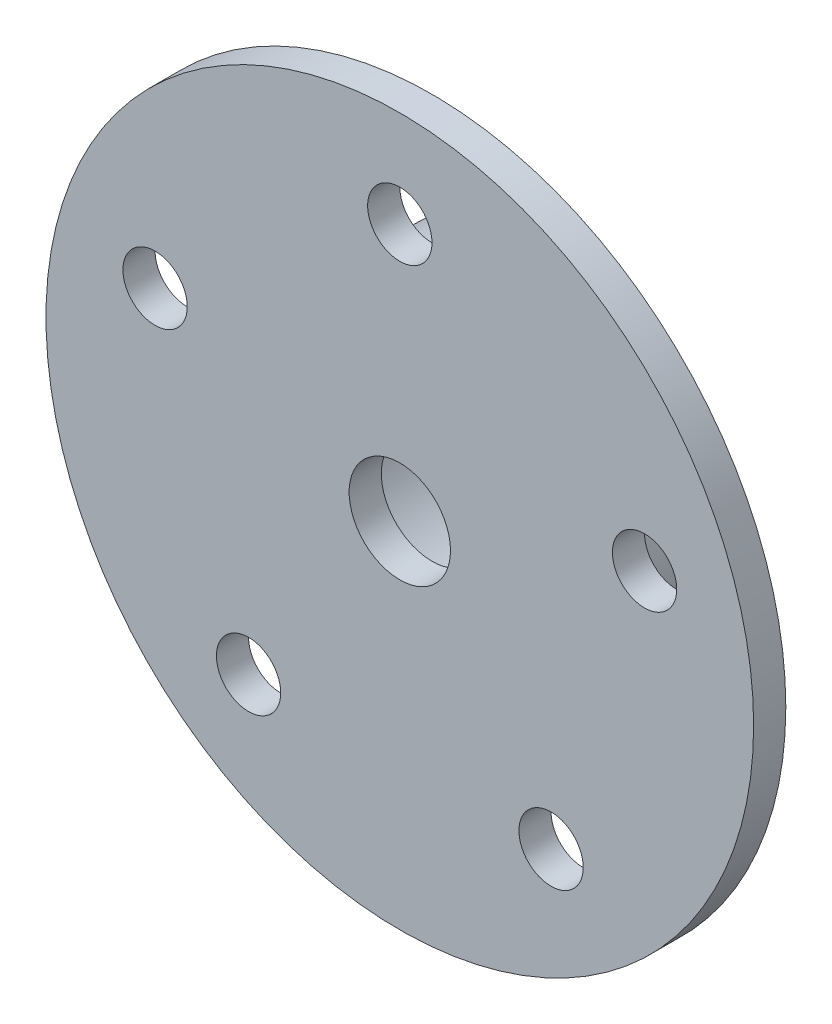
from build123d import *

# Parameters (mm, degrees)
SKETCH_1_R      = 22
SKETCH_1_R_2    = 3.15
SKETCH_1_R_3    = 2
EXTRUDE_1_DEPTH = 2
SKETCH_3_R      = 11
SKETCH_3_R_2    = 7.6
EXTRUDE_2_DEPTH = 7


with BuildPart() as part:
    # 草图1 → 凸台-拉伸1 (new body)
    with BuildSketch(Plane.XY):
        Circle(SKETCH_1_R)
        Circle(SKETCH_1_R_2, mode=Mode.SUBTRACT)
        with Locations((0, 16)):
            Circle(SKETCH_1_R_3, mode=Mode.SUBTRACT)
        with Locations((15.216904261, 4.94427191)):
            Circle(SKETCH_1_R_3, mode=Mode.SUBTRACT)
        with Locations((9.404564037, -12.94427191)):
            Circle(SKETCH_1_R_3, mode=Mode.SUBTRACT)
        with Locations((-9.404564037, -12.94427191)):
            Circle(SKETCH_1_R_3, mode=Mode.SUBTRACT)
        with Locations((-15.216904261, 4.94427191)):
            Circle(SKETCH_1_R_3, mode=Mode.SUBTRACT)
    extrude(amount=EXTRUDE_1_DEPTH)

    # 草图3 → 凸台-拉伸2 (add)
    with BuildSketch(Plane(origin=(0, 0, 0), x_dir=(-1, 0, 0), z_dir=(0, 0, -1))):
        with Locations(Location((0, 0, 0), (0, 0, 180))):
            Circle(SKETCH_3_R)
        Circle(SKETCH_3_R_2, mode=Mode.SUBTRACT)
    extrude(amount=EXTRUDE_2_DEPTH)


solid = part.part
